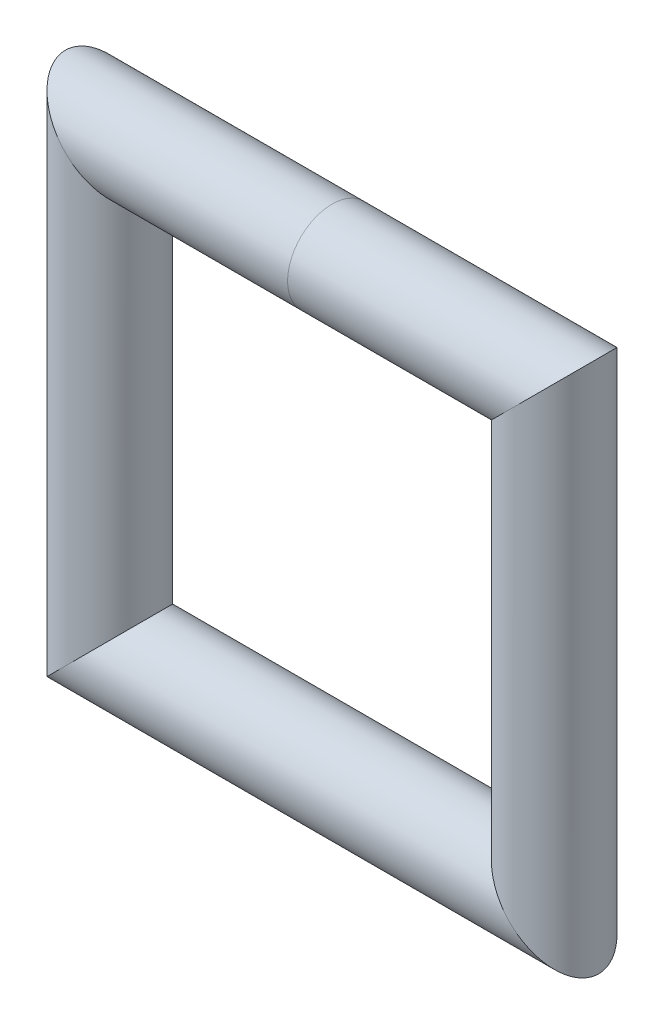
from build123d import *

# Parameters (mm, degrees)
SKETCH_2_R = 2.5


with BuildPart() as part:
    # 扫描1: sweep along a path in 草图1
    with BuildLine(Plane.XY) as sweep_1_path:
        Line((-25, -25), (25, -25))
        Line((25, -25), (25, 25))
        Line((25, 25), (-25, 25))
        Line((-25, 25), (-25, -25))
    # 草图2 → 扫描1 (sweep)
    with BuildSketch(Plane(origin=(0, 0, 0), x_dir=(0, 0, -1), z_dir=(1, 0, 0))):
        with Locations((0, 12.5)):
            Circle(SKETCH_2_R)
    sweep(path=sweep_1_path.line, transition=Transition.RIGHT)


solid = part.part
